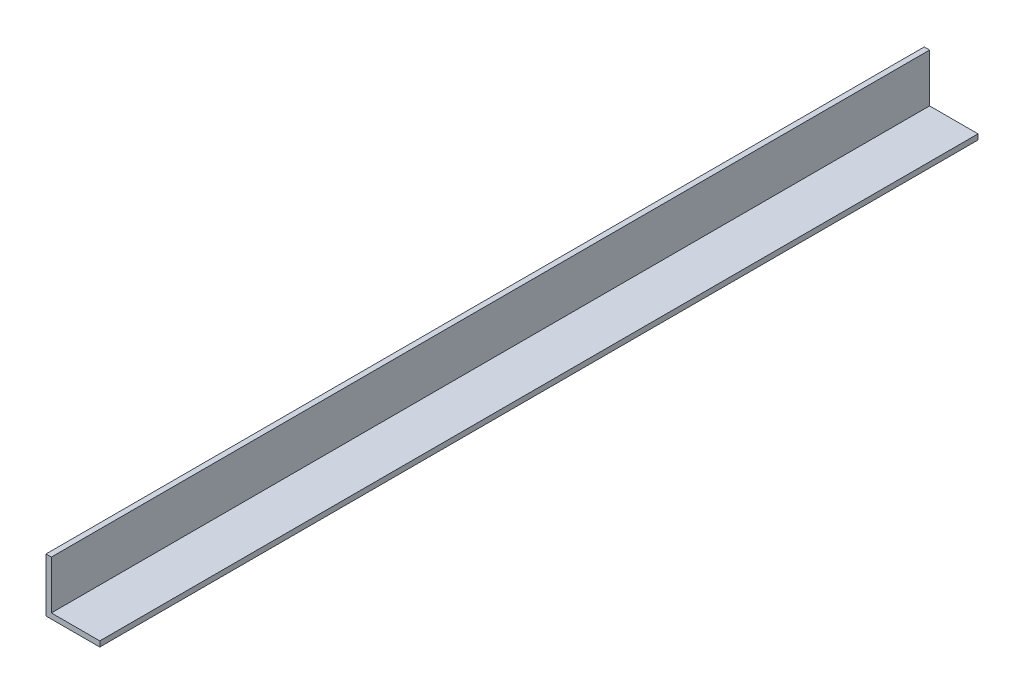
from build123d import *

# Parameters (mm, degrees)
EXTRUDE_1_DEPTH = 490


with BuildPart() as part:
    # Эскиз1 → Бобышка-Вытянуть1 (new body)
    with BuildSketch(Plane.XY):
        Polygon((0, 0), (0, 30), (3, 30), (3, 3), (30, 3), (30, 0), align=None)
    extrude(amount=EXTRUDE_1_DEPTH)


solid = part.part
